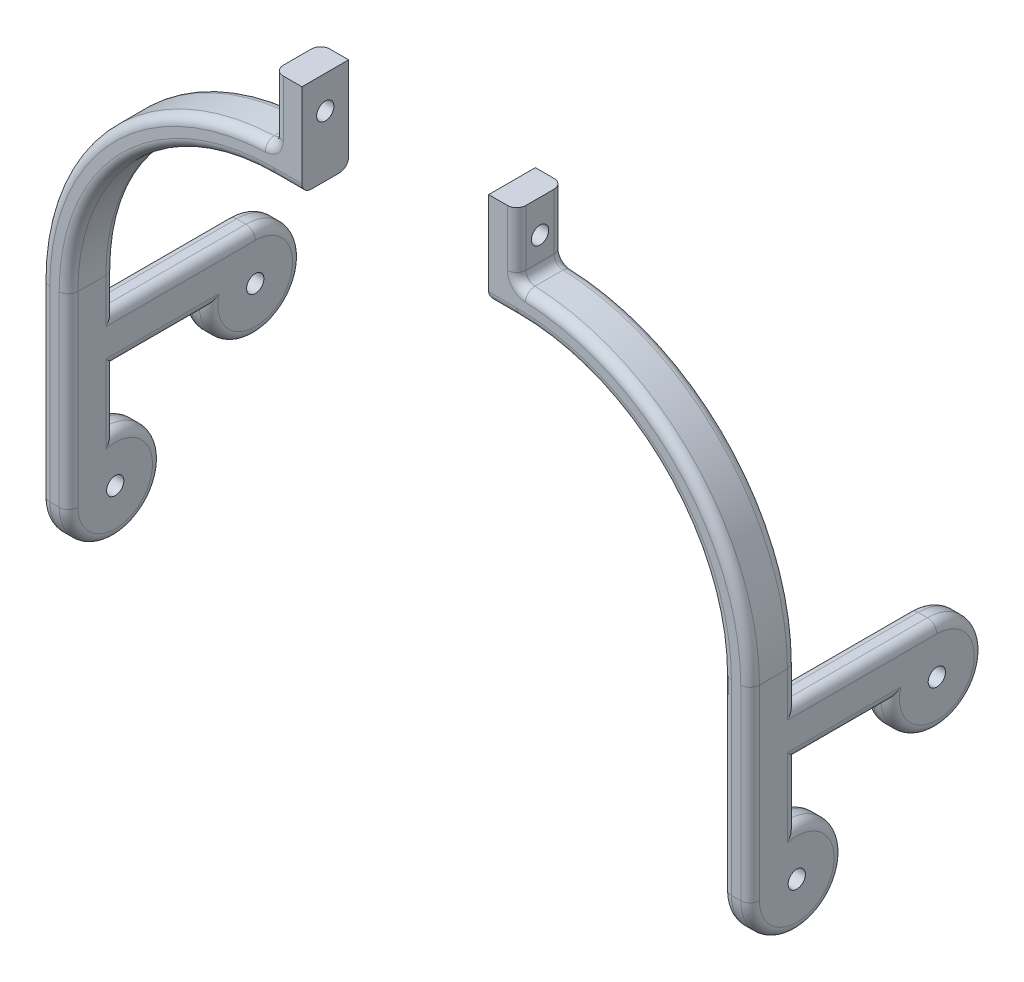
from build123d import *

# Parameters (mm, degrees)
BOSS_EXTRUDE2_DEPTH     = 10
BOSS_EXTRUDE2_2_DEPTH   = 10
CUT_EXTRUDE1_DEPTH      = 133.514150188
CUT_EXTRUDE1_DEPTH_BACK = 133.514150188
SKETCH2_R               = 1.85
SKETCH5_R               = 10
BOSS_EXTRUDE5_DEPTH     = 6
SKETCH6_W               = 30
SKETCH6_H               = 10
BOSS_EXTRUDE6_DEPTH     = 6
SKETCH7_R               = 10
BOSS_EXTRUDE7_DEPTH     = 6
BOSS_EXTRUDE10_START    = -6
SKETCH8_R               = 10
BOSS_EXTRUDE10_DEPTH    = 6
SKETCH13_W              = 30
SKETCH13_H              = 10
BOSS_EXTRUDE13_DEPTH    = 6
BOSS_EXTRUDE14_START    = -6
SKETCH14_R              = 10
BOSS_EXTRUDE14_DEPTH    = 6
CUT_EXTRUDE4_DEPTH      = 184.139291251
CUT_EXTRUDE4_DEPTH_BACK = 184.139291251
SKETCH15_R              = 1.85
FILLET2_R               = 2
FILLET3_R               = 2
FILLET4_R               = 2
FILLET5_R               = 2


with BuildPart() as part:
    # Sketch1 → Boss-Extrude2 (new body)
    with BuildSketch(Plane.XY):
        with BuildLine():
            Line((0, 0), (0, 20))
            Line((0, 20), (-6, 20))
            Line((-6, 20), (-6, 6))
            ThreePointArc((-6, 6), (-41.355339059, -8.644660941), (-56, -44))
            Line((-56, -44), (-56, -84))
            Line((-56, -84), (-50, -84))
            Line((-50, -84), (-50, -44))
            ThreePointArc((-50, -44), (-37.112698372, -12.887301628), (-6, 0))
            Line((-6, 0), (0, 0))
        make_face()
    extrude(amount=BOSS_EXTRUDE2_DEPTH)


with BuildPart() as body_2:
    # Sketch1 → Boss-Extrude2 2 (new body)
    with BuildSketch(Plane.XY):
        with BuildLine():
            Line((96, -84), (90, -84))
            Line((90, -84), (90, -44))
            ThreePointArc((90, -44), (77.112698372, -12.887301628), (46, 0))
            Line((46, 0), (40, 0))
            Line((40, 0), (40, 20))
            Line((40, 20), (46, 20))
            Line((46, 20), (46, 6))
            ThreePointArc((46, 6), (81.355339059, -8.644660941), (96, -44))
            Line((96, -44), (96, -84))
        make_face()
    extrude(amount=BOSS_EXTRUDE2_2_DEPTH)


with BuildPart() as cut_extrude1_tool:
    # Sketch2 → Cut-Extrude1 (new, two sides: drawn at the far end of the back side and taken through both)
    with BuildSketch(Plane(origin=(46, 0, 0), x_dir=(0, 0, -1), z_dir=(1, 0, 0)).offset(-CUT_EXTRUDE1_DEPTH_BACK)):
        with Locations((-5, 13)):
            Circle(SKETCH2_R)
    extrude(amount=CUT_EXTRUDE1_DEPTH + CUT_EXTRUDE1_DEPTH_BACK)


with BuildPart() as part_1:
    add(part.part)

    # Cut-Extrude1: cut by cut_extrude1_tool
    add(cut_extrude1_tool.part, mode=Mode.SUBTRACT)

    # Sketch5 → Boss-Extrude5 (add)
    with BuildSketch(Plane.ZY.offset(56)):
        with Locations((0, -84)):
            Circle(SKETCH5_R)
    extrude(amount=-BOSS_EXTRUDE5_DEPTH)

    # Sketch6 → Boss-Extrude6 (add)
    with BuildSketch(Plane.ZY.offset(56)):
        with Locations((-15, -56.5)):
            Rectangle(SKETCH6_W, SKETCH6_H)
    extrude(amount=-BOSS_EXTRUDE6_DEPTH)

    # Sketch7 → Boss-Extrude7 (add)
    with BuildSketch(Plane.ZY.offset(56)):
        with Locations((-30, -61.5)):
            Circle(SKETCH7_R)
    extrude(amount=-BOSS_EXTRUDE7_DEPTH)


with BuildPart() as body_2_1:
    add(body_2.part)

    # Cut-Extrude1: cut by cut_extrude1_tool
    add(cut_extrude1_tool.part, mode=Mode.SUBTRACT)

    # Sketch8 → Boss-Extrude10 (add)
    with BuildSketch(Plane(origin=(96, 0, 0), x_dir=(0, 0, -1), z_dir=(1, 0, 0)).offset(BOSS_EXTRUDE10_START)):
        with Locations((0, -84)):
            Circle(SKETCH8_R)
    extrude(amount=BOSS_EXTRUDE10_DEPTH)

    # Sketch13 → Boss-Extrude13 (add)
    with BuildSketch(Plane(origin=(96, 0, 0), x_dir=(0, 0, -1), z_dir=(1, 0, 0))):
        with Locations((15, -56.5)):
            Rectangle(SKETCH13_W, SKETCH13_H)
    extrude(amount=-BOSS_EXTRUDE13_DEPTH)

    # Sketch14 → Boss-Extrude14 (add)
    with BuildSketch(Plane(origin=(96, 0, 0), x_dir=(0, 0, -1), z_dir=(1, 0, 0)).offset(BOSS_EXTRUDE14_START)):
        with Locations((30, -61.5)):
            Circle(SKETCH14_R)
    extrude(amount=BOSS_EXTRUDE14_DEPTH)


with BuildPart() as cut_extrude4_tool:
    # Sketch15 → Cut-Extrude4 (new, two sides: drawn at the far end of the back side and taken through both)
    with BuildSketch(Plane.ZY.offset(56).offset(-CUT_EXTRUDE4_DEPTH_BACK)):
        with Locations(Location((-30, -61.5, 0), (0, 0, 270))):
            Circle(SKETCH15_R)
        with Locations(Location((0, -84, 0), (0, 0, 270))):
            Circle(SKETCH15_R)
    extrude(amount=CUT_EXTRUDE4_DEPTH + CUT_EXTRUDE4_DEPTH_BACK)


with BuildPart() as part_2:
    add(part_1.part)

    # Cut-Extrude4: cut by cut_extrude4_tool
    add(cut_extrude4_tool.part, mode=Mode.SUBTRACT)

    # Fillet4
    fillet4_edges = [part_2.edges().sort_by_distance(p)[0] for p in [
        (-41.355339059, -8.644660941, 0),
        (-6, 13, 0),
        (-6, 13, 10),
        (-6, 6, 5),
        (-41.355339059, -8.644660941, 10),
        (-56, -64, 10),
        (-56, -91.071067812, -7.071067812),
        (-56, -67.75, 0),
        (-56, -51.5, -15),
        (-56, -61.5, -10),
        (-56, -68.571067812, -37.071067812),
        (-56, -47.75, 0),
    ]]
    fillet(fillet4_edges, radius=FILLET4_R)

    # Fillet5
    fillet5_edges = [part_2.edges().sort_by_distance(p)[0] for p in [
        (-3, 0, 0),
        (-50, -64, 10),
        (-37.112698372, -12.887301628, 10),
        (-50, -67.75, 0),
        (-50, -91.071067812, -7.071067812),
        (-3, 0, 10),
        (-50, -47.75, 0),
        (-50, -51.5, -15),
        (-50, -61.5, -10),
        (-50, -68.571067812, -37.071067812),
        (-37.112698372, -12.887301628, 0),
    ]]
    fillet(fillet5_edges, radius=FILLET5_R)


with BuildPart() as body_2_2:
    add(body_2_1.part)

    # Cut-Extrude4: cut by cut_extrude4_tool
    add(cut_extrude4_tool.part, mode=Mode.SUBTRACT)

    # Fillet2
    fillet2_edges = [body_2_2.edges().sort_by_distance(p)[0] for p in [
        (90, -64, 10),
        (90, -47.75, 0),
        (77.112698372, -12.887301628, 0),
        (43, 0, 0),
        (40, 0, 5),
        (90, -91.071067812, -7.071067812),
        (43, 0, 10),
        (90, -67.75, 0),
        (90, -51.5, -15),
        (90, -61.5, -10),
        (90, -68.571067812, -37.071067812),
        (77.112698372, -12.887301628, 10),
    ]]
    fillet(fillet2_edges, radius=FILLET2_R)

    # Fillet3
    fillet3_edges = [body_2_2.edges().sort_by_distance(p)[0] for p in [
        (46, 6, 5),
        (96, -64, 10),
        (81.355339059, -8.644660941, 10),
        (46, 13, 10),
        (96, -67.75, 0),
        (96, -91.071067812, -7.071067812),
        (96, -47.75, 0),
        (96, -61.5, -10),
        (96, -51.5, -15),
        (96, -68.571067812, -37.071067812),
        (46, 13, 0),
        (81.355339059, -8.644660941, 0),
    ]]
    fillet(fillet3_edges, radius=FILLET3_R)


solid = Compound([part_2.part, body_2_2.part])
